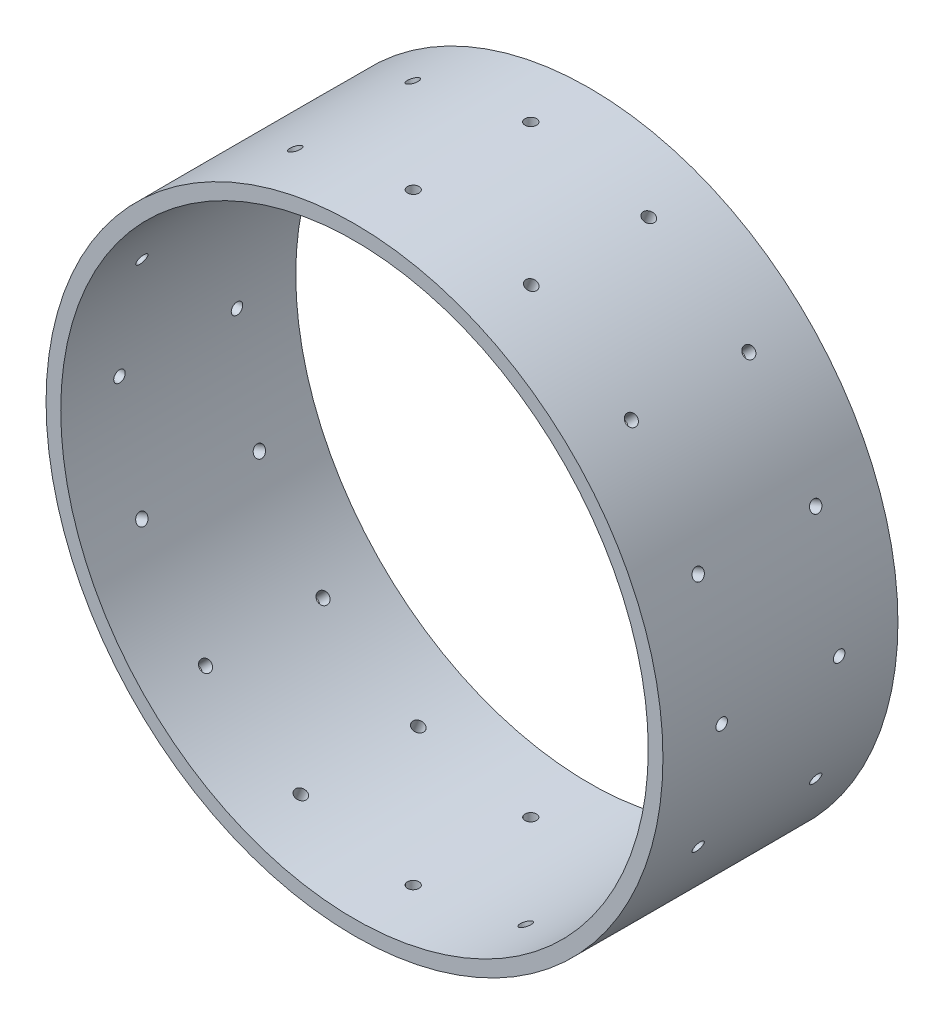
from build123d import *

# Parameters (mm, degrees)
SKETCH1_R                            = 66.675
SKETCH1_R_2                          = 63.5
EXTRUDE1_DEPTH                       = 50.8
F_40_0_098_DIAMETER_HOLE2_AT_2_COUNT = 2
F_40_0_098_DIAMETER_HOLE2_AT_2_PITCH = 25.4
CIRPATTERN1_COUNT                    = 16


with BuildPart() as part:
    # Sketch1 → Extrude1 (new body)
    with BuildSketch(Plane.XY):
        Circle(SKETCH1_R)
        Circle(SKETCH1_R_2, mode=Mode.SUBTRACT)
    extrude(amount=EXTRUDE1_DEPTH)

    # Sketch8 → #40 (0.098) Diameter Hole2 (revolve, cut)
    with BuildSketch(Plane(origin=(0, 66.675, 12.7), x_dir=(0, 0, 1), z_dir=(1, 0, 0))):
        Polygon((0, 0), (0, 13.447831126), (1.2446, 12.7), (1.2446, 0), align=None)
    f_40_0_098_diameter_hole2 = revolve(axis=Axis((0, 73.025, 12.7), (0, -1, 0)), mode=Mode.SUBTRACT)

    # #40 (0.098) Diameter Hole2 at 2: #40 (0.098) Diameter Hole2 ×2
    with Locations(*[(0, 0, i * F_40_0_098_DIAMETER_HOLE2_AT_2_PITCH) for i in range(1, F_40_0_098_DIAMETER_HOLE2_AT_2_COUNT)]):
        add(f_40_0_098_diameter_hole2, mode=Mode.SUBTRACT)

    # CirPattern1: #40 (0.098) Diameter Hole2 ×16 about axis
    cirpattern1_axis = Axis((0, 0, 50.8), (0, 0, -1))
    for i in range(1, CIRPATTERN1_COUNT):
        add(f_40_0_098_diameter_hole2.rotate(cirpattern1_axis, i * 360 / CIRPATTERN1_COUNT), mode=Mode.SUBTRACT)

    # CirPattern1 copy 1 sketch → CirPattern1 copy 1 (revolve, cut)
    with BuildSketch(Plane(origin=(25.515417853, 61.59966783, 38.1), x_dir=(0, 0, 1), z_dir=(0.9238795325112867, -0.3826834323650898, 0))):
        Polygon((0, 0), (0, 13.447831126), (1.2446, 12.7), (1.2446, 0), align=None)
    revolve(axis=Axis((27.945457648, 67.466302862, 38.1), (-0.3826834323650898, -0.9238795325112867, 0)), mode=Mode.SUBTRACT)

    # CirPattern1 copy 2 sketch → CirPattern1 copy 2 (revolve, cut)
    with BuildSketch(Plane(origin=(47.146344636, 47.146344636, 38.1), x_dir=(0, 0, 1), z_dir=(0.7071067811865476, -0.7071067811865475, 0))):
        Polygon((0, 0), (0, 13.447831126), (1.2446, 12.7), (1.2446, 0), align=None)
    revolve(axis=Axis((51.636472696, 51.636472696, 38.1), (-0.7071067811865475, -0.7071067811865476, 0)), mode=Mode.SUBTRACT)

    # CirPattern1 copy 3 sketch → CirPattern1 copy 3 (revolve, cut)
    with BuildSketch(Plane(origin=(61.59966783, 25.515417853, 38.1), x_dir=(0, 0, 1), z_dir=(0.38268343236508984, -0.9238795325112867, 0))):
        Polygon((0, 0), (0, 13.447831126), (1.2446, 12.7), (1.2446, 0), align=None)
    revolve(axis=Axis((67.466302862, 27.945457648, 38.1), (-0.9238795325112867, -0.38268343236508984, 0)), mode=Mode.SUBTRACT)

    # CirPattern1 copy 4 sketch → CirPattern1 copy 4 (revolve, cut)
    with BuildSketch(Plane(origin=(66.675, 0, 38.1), x_dir=(0, 0, 1), z_dir=(0, -1, 0))):
        Polygon((0, 0), (0, 13.447831126), (1.2446, 12.7), (1.2446, 0), align=None)
    revolve(axis=Axis((73.025, 0, 38.1), (-1, 0, 0)), mode=Mode.SUBTRACT)

    # CirPattern1 copy 5 sketch → CirPattern1 copy 5 (revolve, cut)
    with BuildSketch(Plane(origin=(61.59966783, -25.515417853, 38.1), x_dir=(0, 0, 1), z_dir=(-0.3826834323650897, -0.9238795325112867, 0))):
        Polygon((0, 0), (0, 13.447831126), (1.2446, 12.7), (1.2446, 0), align=None)
    revolve(axis=Axis((67.466302862, -27.945457648, 38.1), (-0.9238795325112867, 0.3826834323650897, 0)), mode=Mode.SUBTRACT)

    # CirPattern1 copy 6 sketch → CirPattern1 copy 6 (revolve, cut)
    with BuildSketch(Plane(origin=(47.146344636, -47.146344636, 38.1), x_dir=(0, 0, 1), z_dir=(-0.7071067811865475, -0.7071067811865476, 0))):
        Polygon((0, 0), (0, 13.447831126), (1.2446, 12.7), (1.2446, 0), align=None)
    revolve(axis=Axis((51.636472696, -51.636472696, 38.1), (-0.7071067811865476, 0.7071067811865475, 0)), mode=Mode.SUBTRACT)

    # CirPattern1 copy 7 sketch → CirPattern1 copy 7 (revolve, cut)
    with BuildSketch(Plane(origin=(25.515417853, -61.59966783, 38.1), x_dir=(0, 0, 1), z_dir=(-0.9238795325112867, -0.3826834323650899, 0))):
        Polygon((0, 0), (0, 13.447831126), (1.2446, 12.7), (1.2446, 0), align=None)
    revolve(axis=Axis((27.945457648, -67.466302862, 38.1), (-0.3826834323650899, 0.9238795325112867, 0)), mode=Mode.SUBTRACT)

    # CirPattern1 copy 8 sketch → CirPattern1 copy 8 (revolve, cut)
    with BuildSketch(Plane(origin=(0, -66.675, 38.1), x_dir=(0, 0, 1), z_dir=(-1, 0, 0))):
        Polygon((0, 0), (0, 13.447831126), (1.2446, 12.7), (1.2446, 0), align=None)
    revolve(axis=Axis((0, -73.025, 38.1), (0, 1, 0)), mode=Mode.SUBTRACT)

    # CirPattern1 copy 9 sketch → CirPattern1 copy 9 (revolve, cut)
    with BuildSketch(Plane(origin=(-25.515417853, -61.59966783, 38.1), x_dir=(0, 0, 1), z_dir=(-0.9238795325112868, 0.38268343236508967, 0))):
        Polygon((0, 0), (0, 13.447831126), (1.2446, 12.7), (1.2446, 0), align=None)
    revolve(axis=Axis((-27.945457648, -67.466302862, 38.1), (0.38268343236508967, 0.9238795325112868, 0)), mode=Mode.SUBTRACT)

    # CirPattern1 copy 10 sketch → CirPattern1 copy 10 (revolve, cut)
    with BuildSketch(Plane(origin=(-47.146344636, -47.146344636, 38.1), x_dir=(0, 0, 1), z_dir=(-0.7071067811865477, 0.7071067811865475, 0))):
        Polygon((0, 0), (0, 13.447831126), (1.2446, 12.7), (1.2446, 0), align=None)
    revolve(axis=Axis((-51.636472696, -51.636472696, 38.1), (0.7071067811865475, 0.7071067811865477, 0)), mode=Mode.SUBTRACT)

    # CirPattern1 copy 11 sketch → CirPattern1 copy 11 (revolve, cut)
    with BuildSketch(Plane(origin=(-61.59966783, -25.515417853, 38.1), x_dir=(0, 0, 1), z_dir=(-0.3826834323650895, 0.9238795325112868, 0))):
        Polygon((0, 0), (0, 13.447831126), (1.2446, 12.7), (1.2446, 0), align=None)
    revolve(axis=Axis((-67.466302862, -27.945457648, 38.1), (0.9238795325112868, 0.3826834323650895, 0)), mode=Mode.SUBTRACT)

    # CirPattern1 copy 12 sketch → CirPattern1 copy 12 (revolve, cut)
    with BuildSketch(Plane(origin=(-66.675, 0, 38.1), x_dir=(0, 0, 1), z_dir=(0, 1, 0))):
        Polygon((0, 0), (0, 13.447831126), (1.2446, 12.7), (1.2446, 0), align=None)
    revolve(axis=Axis((-73.025, 0, 38.1), (1, 0, 0)), mode=Mode.SUBTRACT)

    # CirPattern1 copy 13 sketch → CirPattern1 copy 13 (revolve, cut)
    with BuildSketch(Plane(origin=(-61.59966783, 25.515417853, 38.1), x_dir=(0, 0, 1), z_dir=(0.38268343236509, 0.9238795325112866, 0))):
        Polygon((0, 0), (0, 13.447831126), (1.2446, 12.7), (1.2446, 0), align=None)
    revolve(axis=Axis((-67.466302862, 27.945457648, 38.1), (0.9238795325112866, -0.38268343236509, 0)), mode=Mode.SUBTRACT)

    # CirPattern1 copy 14 sketch → CirPattern1 copy 14 (revolve, cut)
    with BuildSketch(Plane(origin=(-47.146344636, 47.146344636, 38.1), x_dir=(0, 0, 1), z_dir=(0.7071067811865474, 0.7071067811865477, 0))):
        Polygon((0, 0), (0, 13.447831126), (1.2446, 12.7), (1.2446, 0), align=None)
    revolve(axis=Axis((-51.636472696, 51.636472696, 38.1), (0.7071067811865477, -0.7071067811865474, 0)), mode=Mode.SUBTRACT)

    # CirPattern1 copy 15 sketch → CirPattern1 copy 15 (revolve, cut)
    with BuildSketch(Plane(origin=(-25.515417853, 61.59966783, 38.1), x_dir=(0, 0, 1), z_dir=(0.9238795325112868, 0.38268343236508956, 0))):
        Polygon((0, 0), (0, 13.447831126), (1.2446, 12.7), (1.2446, 0), align=None)
    revolve(axis=Axis((-27.945457648, 67.466302862, 38.1), (0.38268343236508956, -0.9238795325112868, 0)), mode=Mode.SUBTRACT)


solid = part.part
